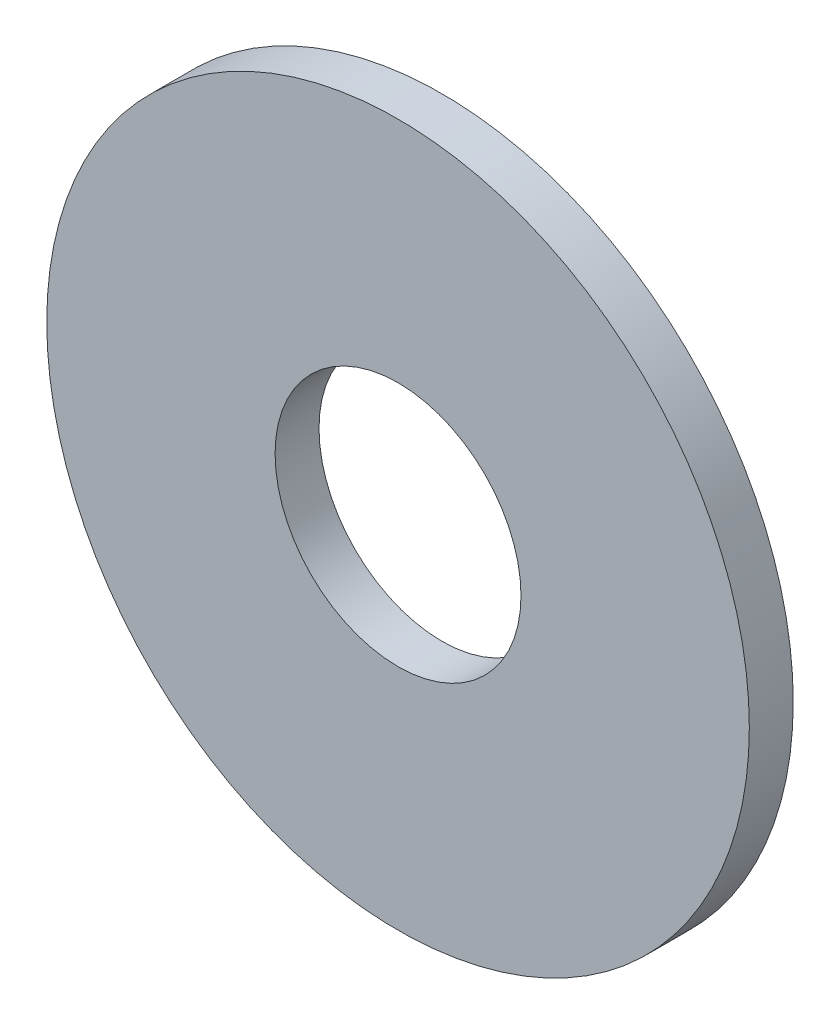
from build123d import *

# Parameters (mm, degrees)
ESQUISSE1_R             = 12
BOSS_EXTRU_1_DEPTH      = 1.5
ESQUISSE2_R             = 4.2
ENL_V_MAT_EXTRU_1_DEPTH = 1.5


with BuildPart() as part:
    # Esquisse1 → Boss.-Extru.1 (new body)
    with BuildSketch(Plane.XY):
        Circle(ESQUISSE1_R)
    extrude(amount=BOSS_EXTRU_1_DEPTH)

    # Esquisse2 → Enlèv. mat.-Extru.1 (cut)
    with BuildSketch(Plane.XY.offset(1.5)):
        Circle(ESQUISSE2_R)
    extrude(amount=-ENL_V_MAT_EXTRU_1_DEPTH, mode=Mode.SUBTRACT)


solid = part.part
